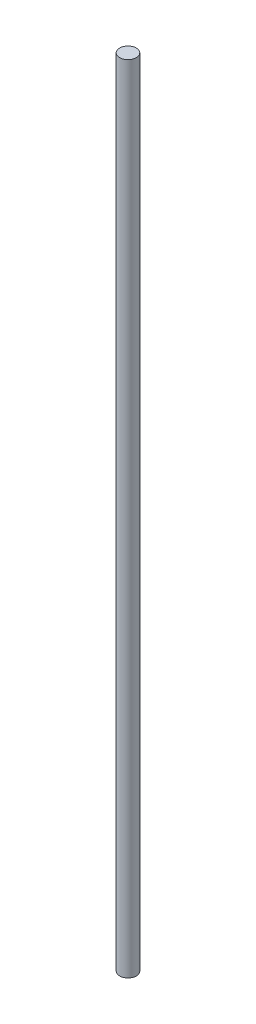
from build123d import *

# Parameters (mm, degrees)
SKETCH1_R           = 1.5
BOSS_EXTRUDE1_DEPTH = 143


with BuildPart() as part:
    # Sketch1 → Boss-Extrude1 (new body)
    with BuildSketch(Plane(origin=(0, 0, 0), x_dir=(1, 0, 0), z_dir=(0, 1, 0))):
        with Locations(Location((0, 0, 0), (0, 0, 270))):
            Circle(SKETCH1_R)
    extrude(amount=BOSS_EXTRUDE1_DEPTH)


solid = part.part
